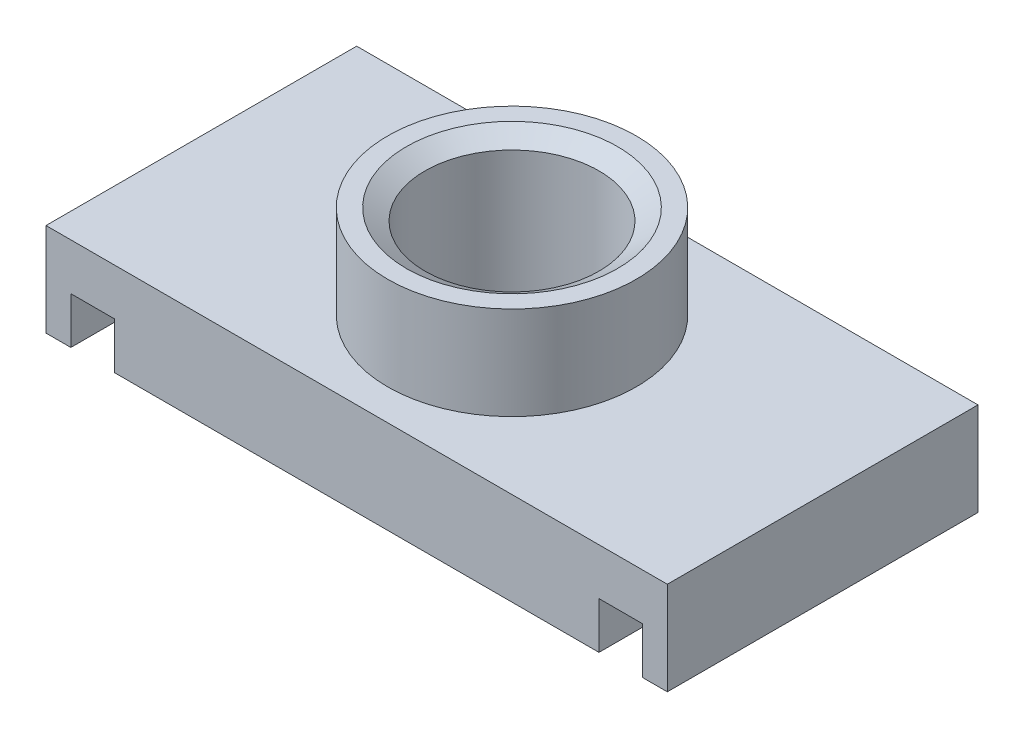
from build123d import *

# Parameters (mm, degrees)
SKETCH1_R               = 20
SKETCH1_R_2             = 14
BOSS_EXTRUDE1_DEPTH     = 30
SKETCH3_W               = 17
SKETCH3_H               = 4.747307011
SKETCH4_W               = 100
SKETCH4_H               = 50
SKETCH4_R               = 14
BOSS_EXTRUDE2_DEPTH     = 15
CUT_EXTRUDE2_DEPTH      = 64.442887702
CUT_EXTRUDE2_DEPTH_BACK = 64.442887702
SKETCH5_W               = 7
SKETCH5_H               = 15


with BuildPart() as part:
    # Sketch1 → Boss-Extrude1 (new body)
    with BuildSketch(Plane(origin=(0, 0, 0), x_dir=(1, 0, 0), z_dir=(0, 1, 0))):
        with Locations(Location((0, 0, 0), (0, 0, 270))):
            Circle(SKETCH1_R)
        with Locations(Location((0, 0, 0), (0, 0, 270))):
            Circle(SKETCH1_R_2, mode=Mode.SUBTRACT)
    extrude(amount=BOSS_EXTRUDE1_DEPTH)

    # Sketch3 → Cut-Revolve2 (revolve, cut)
    with BuildSketch(Plane.XY, mode=Mode.PRIVATE) as cut_revolve2_sk:
        Polygon((-17, 30), (-0.03686902, 19.405086722), (0, 30), align=None)
        with Locations((-8.5, 32.373653506)):
            Rectangle(SKETCH3_W, SKETCH3_H)
    revolve(cut_revolve2_sk.sketch.rotate(Axis((0, 34.747307011, 0), (0, -1, 0)), 270), axis=Axis((0, 34.747307011, 0), (0, -1, 0)), mode=Mode.SUBTRACT)

    # Sketch4 → Boss-Extrude2 (add)
    with BuildSketch(Plane(origin=(0, 0, 0), x_dir=(1, 0, 0), z_dir=(0, 1, 0))):
        Rectangle(SKETCH4_W, SKETCH4_H)
        with Locations(Location((0, 0, 0), (0, 0, 270))):
            Circle(SKETCH4_R, mode=Mode.SUBTRACT)
    extrude(amount=BOSS_EXTRUDE2_DEPTH)

    # Sketch5 → Cut-Extrude2 (cut, two sides: drawn at the far end of the back side and taken through both)
    with BuildSketch(Plane.XY.offset(-CUT_EXTRUDE2_DEPTH_BACK)):
        with Locations((-42.5, 0)):
            Rectangle(SKETCH5_W, SKETCH5_H)
        with Locations((42.5, 0)):
            Rectangle(SKETCH5_W, SKETCH5_H)
    extrude(amount=CUT_EXTRUDE2_DEPTH + CUT_EXTRUDE2_DEPTH_BACK, mode=Mode.SUBTRACT)


solid = part.part
